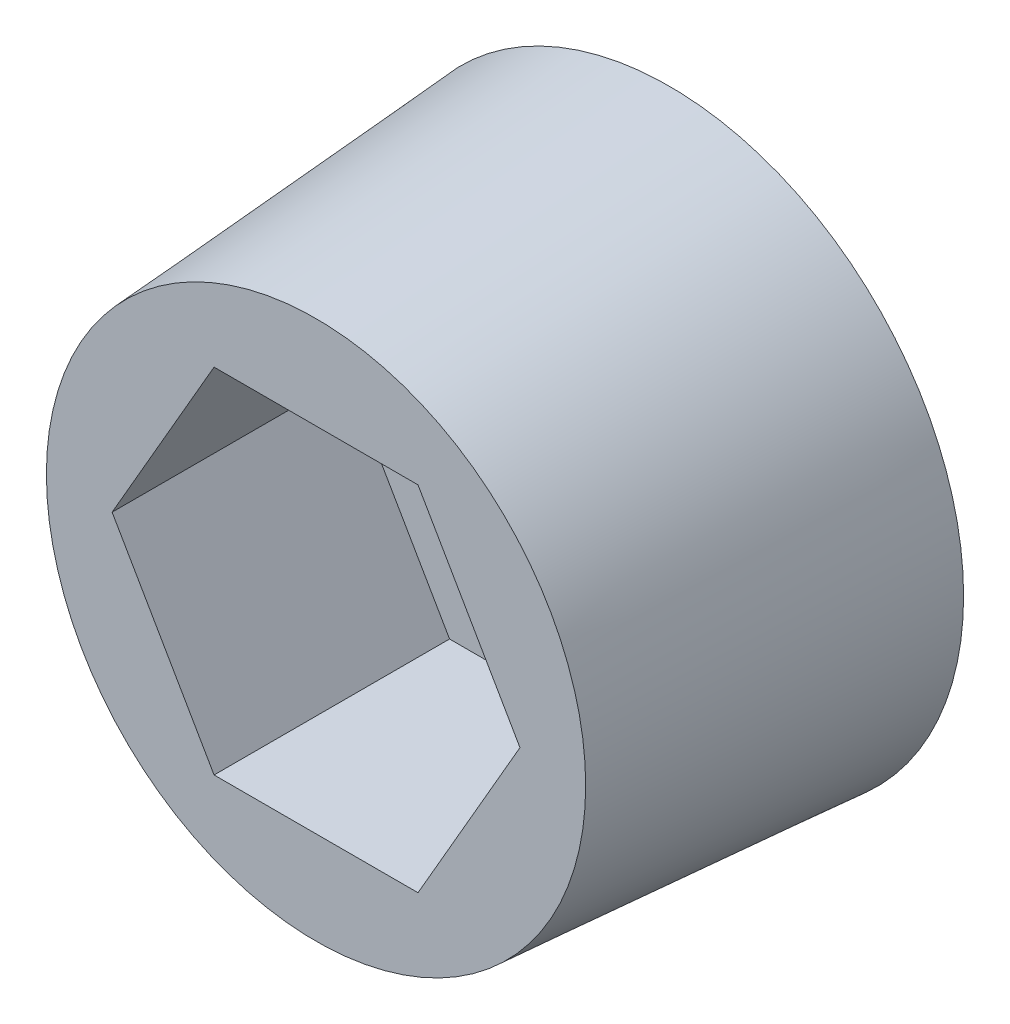
from build123d import *

# Parameters (mm, degrees)
SKETCH1_R           = 5
BOSS_EXTRUDE1_DEPTH = 6
BOSS_EXTRUDE1_TAPER = 4
CUT_EXTRUDE1_DEPTH  = 4
SKETCH4_R           = 1.65
CUT_EXTRUDE2_DEPTH  = 9.124038405


with BuildPart() as part:
    # Sketch1 → Boss-Extrude1 (new body)
    with BuildSketch(Plane.XY):
        Circle(SKETCH1_R)
    extrude(amount=BOSS_EXTRUDE1_DEPTH, taper=BOSS_EXTRUDE1_TAPER)

    # Sketch2 → Cut-Extrude1 (cut)
    with BuildSketch(Plane.XY.offset(6)):
        Polygon((1.732050808, 3), (-1.732050808, 3), (-3.464101615, 0), (-1.732050808, -3), (1.732050808, -3), (3.464101615, 0), align=None)
    extrude(amount=-CUT_EXTRUDE1_DEPTH, mode=Mode.SUBTRACT)

    # Sketch4 → Cut-Extrude2 (cut, through all)
    with BuildSketch(Plane.XY.offset(2)):
        Circle(SKETCH4_R)
    extrude(amount=-CUT_EXTRUDE2_DEPTH, mode=Mode.SUBTRACT)


solid = part.part
